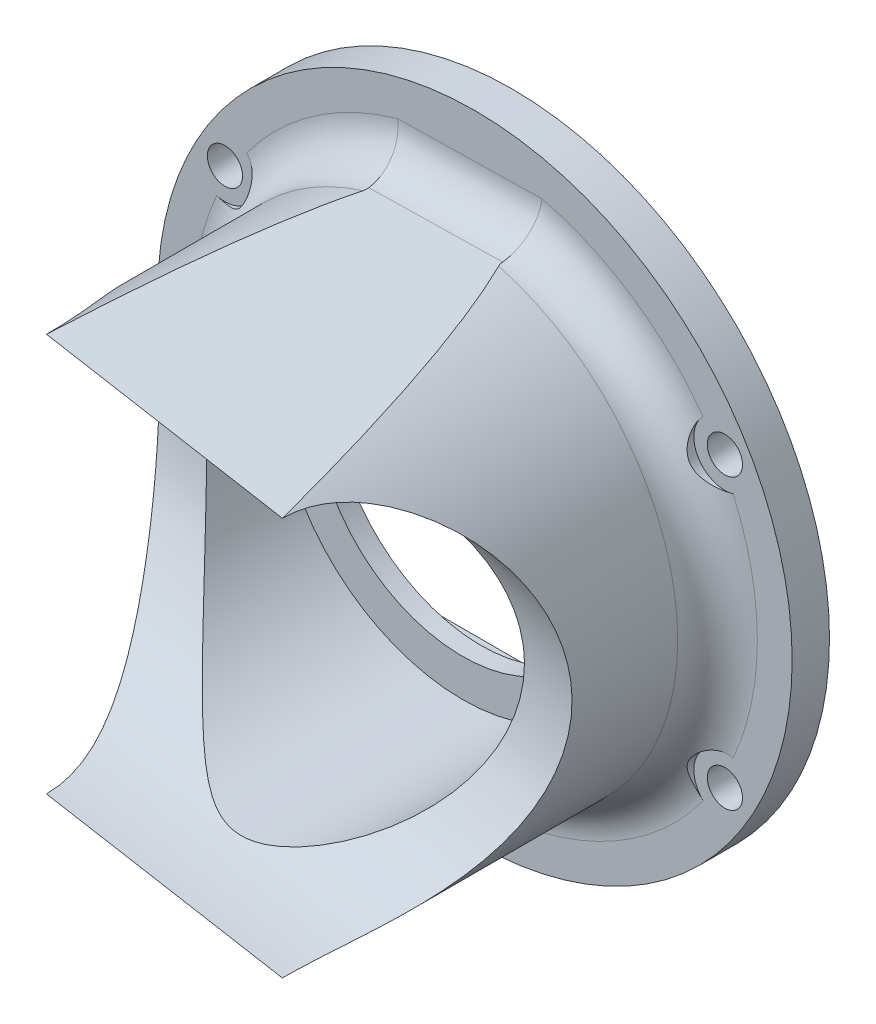
from build123d import *

# Parameters (mm, degrees)
SKETCH1_R                 = 30.95625
BOSS_EXTRUDE1_DEPTH       = 50.8
CUT_EXTRUDE1_DEPTH        = 3.9624
CUT_EXTRUDE2_DEPTH        = 86.860858779
CUT_EXTRUDE2_DEPTH_BACK   = 86.860858779
SKETCH4_R                 = 19.05
CUT_EXTRUDE3_DEPTH        = 62.40755008
SKETCH6_R                 = 23.8125
CUT_EXTRUDE4_DEPTH        = 44.45
F_4_40_TAPPED_HOLE1_D     = 2.2606
F_4_40_TAPPED_HOLE1_DEPTH = 7.62
F_4_40_TAPPED_HOLE1_TIP   = 0.679152758
SKETCH10_R                = 40.48125
BOSS_EXTRUDE3_DEPTH       = 4.7625
FILLET1_R                 = 5.08
CIRPATTERN1_COUNT         = 2
CIRPATTERN1_ANGLE         = 120
SKETCH15_R                = 3.9624
CUT_EXTRUDE5_DEPTH        = 5.08


with BuildPart() as part:
    # Sketch1 → Boss-Extrude1 (new body)
    with BuildSketch(Plane.XY):
        Circle(SKETCH1_R)
    extrude(amount=BOSS_EXTRUDE1_DEPTH)

    # Sketch2 → Cut-Extrude1 (cut)
    with BuildSketch(Plane(origin=(0, 0, 0), x_dir=(-1, 0, 0), z_dir=(0, 0, -1))):
        with BuildLine():
            Line((-18.3261, -22.2885), (18.3261, -22.2885))
            ThreePointArc((18.3261, -22.2885), (21.12793991, -21.12793991), (22.2885, -18.3261))
            Line((22.2885, -18.3261), (22.2885, 18.3261))
            ThreePointArc((22.2885, 18.3261), (21.12793991, 21.12793991), (18.3261, 22.2885))
            Line((18.3261, 22.2885), (-18.3261, 22.2885))
            ThreePointArc((-18.3261, 22.2885), (-21.12793991, 21.12793991), (-22.2885, 18.3261))
            Line((-22.2885, 18.3261), (-22.2885, -18.3261))
            ThreePointArc((-22.2885, -18.3261), (-21.12793991, -21.12793991), (-18.3261, -22.2885))
        make_face()
    extrude(amount=-CUT_EXTRUDE1_DEPTH, mode=Mode.SUBTRACT)

    # Sketch3 → Cut-Extrude2 (cut, two sides: drawn at the far end of the back side and taken through both)
    with BuildSketch(Plane(origin=(30.95625, 0, 0), x_dir=(0.14780941112961093, 0, -0.9890158633619168), z_dir=(0.9890158633619168, 0, 0.14780941112961093)).offset(-CUT_EXTRUDE2_DEPTH_BACK)):
        with BuildLine():
            Line((-48.467631025, 25.4), (-4.575625083, 30.95625))
            Line((-4.575625083, 30.95625), (-67.517631025, 30.95625))
            Line((-67.517631025, 30.95625), (-67.517631025, -30.95625))
            Line((-67.517631025, -30.95625), (-4.575625083, -30.95625))
            Line((-4.575625083, -30.95625), (-48.467631025, -25.4))
            ThreePointArc((-48.467631025, -25.4), (-23.067631025, 0), (-48.467631025, 25.4))
        make_face()
    extrude(amount=CUT_EXTRUDE2_DEPTH + CUT_EXTRUDE2_DEPTH_BACK, mode=Mode.SUBTRACT)

    # Sketch4 → Cut-Extrude3 (cut, through all)
    with BuildSketch(Plane(origin=(0, 0, 3.9624), x_dir=(-1, 0, 0), z_dir=(0, 0, -1))):
        Circle(SKETCH4_R)
    extrude(amount=-CUT_EXTRUDE3_DEPTH, mode=Mode.SUBTRACT)

    # Sketch6 → Cut-Extrude4 (cut)
    with BuildSketch(Plane.XY.offset(50.8)):
        Circle(SKETCH6_R)
    extrude(amount=-CUT_EXTRUDE4_DEPTH, mode=Mode.SUBTRACT)

    # #4-40 Tapped Hole1
    with Locations(Plane(origin=(0, 0, 3.9624), x_dir=(-1, 0, 0), z_dir=(0, 0, -1))):
        with Locations((-18.2626, 18.2626), (18.2626, 18.2626), (18.2626, -18.2626), (-18.2626, -18.2626)):
            Hole(F_4_40_TAPPED_HOLE1_D / 2, depth=F_4_40_TAPPED_HOLE1_DEPTH)
            with Locations((0, 0, -(F_4_40_TAPPED_HOLE1_DEPTH + F_4_40_TAPPED_HOLE1_TIP / 2))):  # 118° drill point
                Cone(0, F_4_40_TAPPED_HOLE1_D / 2, F_4_40_TAPPED_HOLE1_TIP, mode=Mode.SUBTRACT)

    # Sketch10 → Boss-Extrude3 (add)
    with BuildSketch(Plane(origin=(0, 0, 0), x_dir=(-1, 0, 0), z_dir=(0, 0, -1))):
        Circle(SKETCH10_R)
        with BuildLine():
            Line((-17.695463093, 25.4), (17.695463093, 25.4))
            ThreePointArc((17.695463093, 25.4), (30.95625, 0), (17.695463093, -25.4))
            Line((17.695463093, -25.4), (-17.695463093, -25.4))
            ThreePointArc((-17.695463093, -25.4), (-30.95625, 0), (-17.695463093, 25.4))
        make_face(mode=Mode.SUBTRACT)
    extrude(amount=-BOSS_EXTRUDE3_DEPTH)

    # Fillet1
    fillet1_edges = [part.edges().sort_by_distance(p)[0] for p in [
        (30.95625, 0, 4.7625),
        (-30.95625, 0, 4.7625),
        (-0.567868867, -30.349366054, 4.7625),
        (-0.567868867, 30.349366054, 4.7625),
    ]]
    fillet(fillet1_edges, radius=FILLET1_R)

    # Sketch13 → #8 Clearance Hole1 (revolve, cut)
    with BuildSketch(Plane(origin=(-31.895715621, 18.415, 4.7625), x_dir=(0, -1, 0), z_dir=(1, 0, 0))):
        Polygon((0, 0), (0, 26.750674586), (2.2479, 25.4), (2.2479, 0), align=None)
    f_8_clearance_hole1 = revolve(axis=Axis((-31.895715621, 18.415, 11.1125), (0, 0, -1)), mode=Mode.SUBTRACT)

    # CirPattern1: #8 Clearance Hole1 ×2 about axis
    cirpattern1_axis = Axis((0, 0, 4.7625), (0, 0, -1))
    for i in range(1, CIRPATTERN1_COUNT):
        add(f_8_clearance_hole1.rotate(cirpattern1_axis, i * CIRPATTERN1_ANGLE / (CIRPATTERN1_COUNT - 1)), mode=Mode.SUBTRACT)

    # Mirror1: #8 Clearance Hole1 across plane
    add(f_8_clearance_hole1.mirror(Plane.ZX), mode=Mode.SUBTRACT)

    # Mirror1 copy 1 sketch → Mirror1 copy 1 (revolve, cut)
    with BuildSketch(Plane(origin=(31.895715621, -18.415, 4.7625), x_dir=(-0.866025403784436, -0.5000000000000044, 0), z_dir=(-0.5000000000000044, 0.866025403784436, 0))):
        Polygon((0, 0), (0, -26.750674586), (2.2479, -25.4), (2.2479, 0), align=None)
    revolve(axis=Axis((31.895715621, -18.415, 11.1125), (0, 0, 1)), mode=Mode.SUBTRACT)

    # Sketch15 → Cut-Extrude5 (cut)
    with BuildSketch(Plane.XY.offset(9.8425)):
        with Locations((-31.895715621, 18.415)):
            Circle(SKETCH15_R)
        with Locations((31.895715621, 18.415)):
            Circle(SKETCH15_R)
        with Locations((31.895715621, -18.415)):
            Circle(SKETCH15_R)
        with Locations((-31.895715621, -18.415)):
            Circle(SKETCH15_R)
    extrude(amount=-CUT_EXTRUDE5_DEPTH, mode=Mode.SUBTRACT)


solid = part.part
